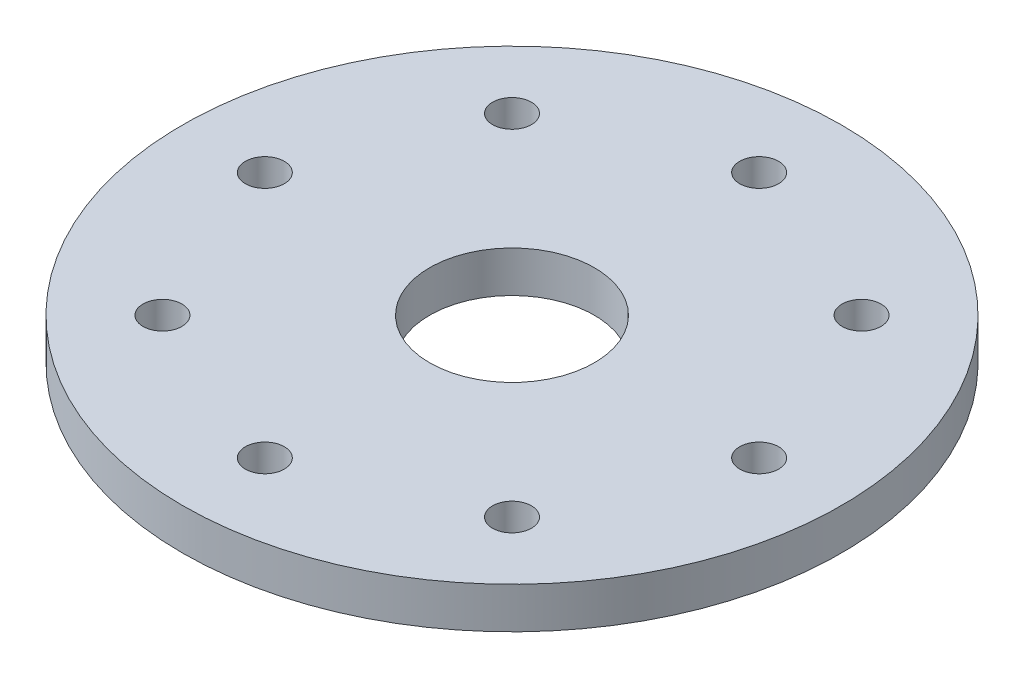
from build123d import *

# Parameters (mm, degrees)
SKETCH1_R           = 25.4
SKETCH1_R_2         = 6.35
SKETCH1_R_3         = 1.500000048
BOSS_EXTRUDE1_DEPTH = 3.175


with BuildPart() as part:
    # Sketch1 → Boss-Extrude1 (new body)
    with BuildSketch(Plane(origin=(0, 0, 0), x_dir=(1, 0, 0), z_dir=(0, 1, 0))):
        Circle(SKETCH1_R)
        Circle(SKETCH1_R_2, mode=Mode.SUBTRACT)
        with Locations((0, 19.05)):
            Circle(SKETCH1_R_3, mode=Mode.SUBTRACT)
        with Locations((13.470384182, 13.470384182)):
            Circle(SKETCH1_R_3, mode=Mode.SUBTRACT)
        with Locations((19.05, 0)):
            Circle(SKETCH1_R_3, mode=Mode.SUBTRACT)
        with Locations((13.470384182, -13.470384182)):
            Circle(SKETCH1_R_3, mode=Mode.SUBTRACT)
        with Locations((0, -19.05)):
            Circle(SKETCH1_R_3, mode=Mode.SUBTRACT)
        with Locations((-13.470384182, -13.470384182)):
            Circle(SKETCH1_R_3, mode=Mode.SUBTRACT)
        with Locations((-19.05, 0)):
            Circle(SKETCH1_R_3, mode=Mode.SUBTRACT)
        with Locations((-13.470384182, 13.470384182)):
            Circle(SKETCH1_R_3, mode=Mode.SUBTRACT)
    extrude(amount=BOSS_EXTRUDE1_DEPTH)


solid = part.part
